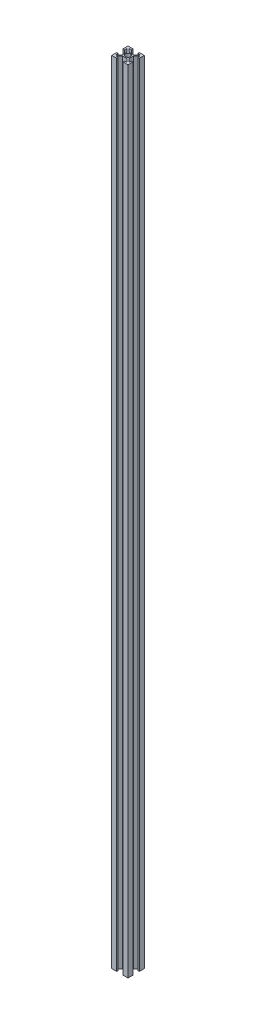
from build123d import *

# Parameters (mm, degrees)
F_2020_SKETCH_R     = 3
BOSS_EXTRUDE1_DEPTH = 972.49


with BuildPart() as part:
    # 2020 sketch → Boss-Extrude1 (new body)
    with BuildSketch(Plane(origin=(0, 0, 0), x_dir=(1, 0, 0), z_dir=(0, 1, 0))):
        Polygon((-4, 10), (-4, 8), (-7, 8), (-3, 4), (3, 4), (7, 8), (4, 8), (4, 10), (10, 10), (10, 4), (8, 4), (8, 7), (4, 3), (4, -3), (8, -7), (8, -4), (10, -4), (10, -10), (4, -10), (4, -8), (7, -8), (3, -4), (-3, -4), (-7, -8), (-4, -8), (-4, -10), (-10, -10), (-10, -4), (-8, -4), (-8, -7), (-4, -3), (-4, 3), (-8, 7), (-8, 4), (-10, 4), (-10, 10), align=None)
        with Locations(Location((0, 0, 0), (0, 0, 270))):
            Circle(F_2020_SKETCH_R, mode=Mode.SUBTRACT)
    extrude(amount=BOSS_EXTRUDE1_DEPTH)


solid = part.part
